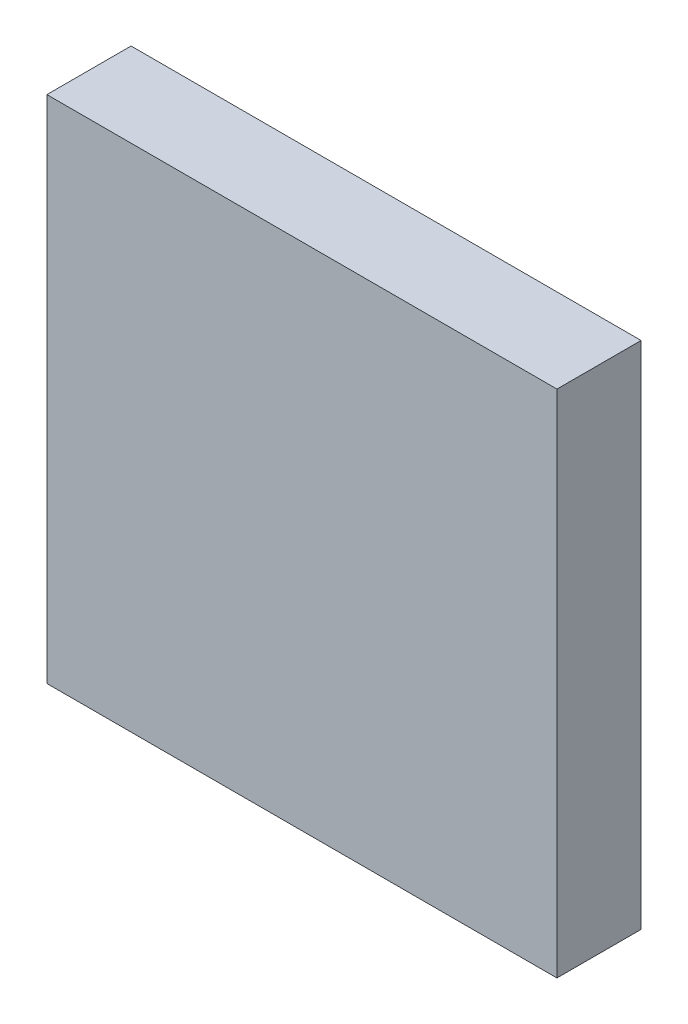
from build123d import *

# Parameters (mm, degrees)
SKETCH2_W           = 20
SKETCH2_H           = 20
BOSS_EXTRUDE1_DEPTH = 3.3


with BuildPart() as part:
    # Sketch2 → Boss-Extrude1 (new body)
    with BuildSketch(Plane.XY):
        Rectangle(SKETCH2_W, SKETCH2_H)
    extrude(amount=BOSS_EXTRUDE1_DEPTH)


solid = part.part
